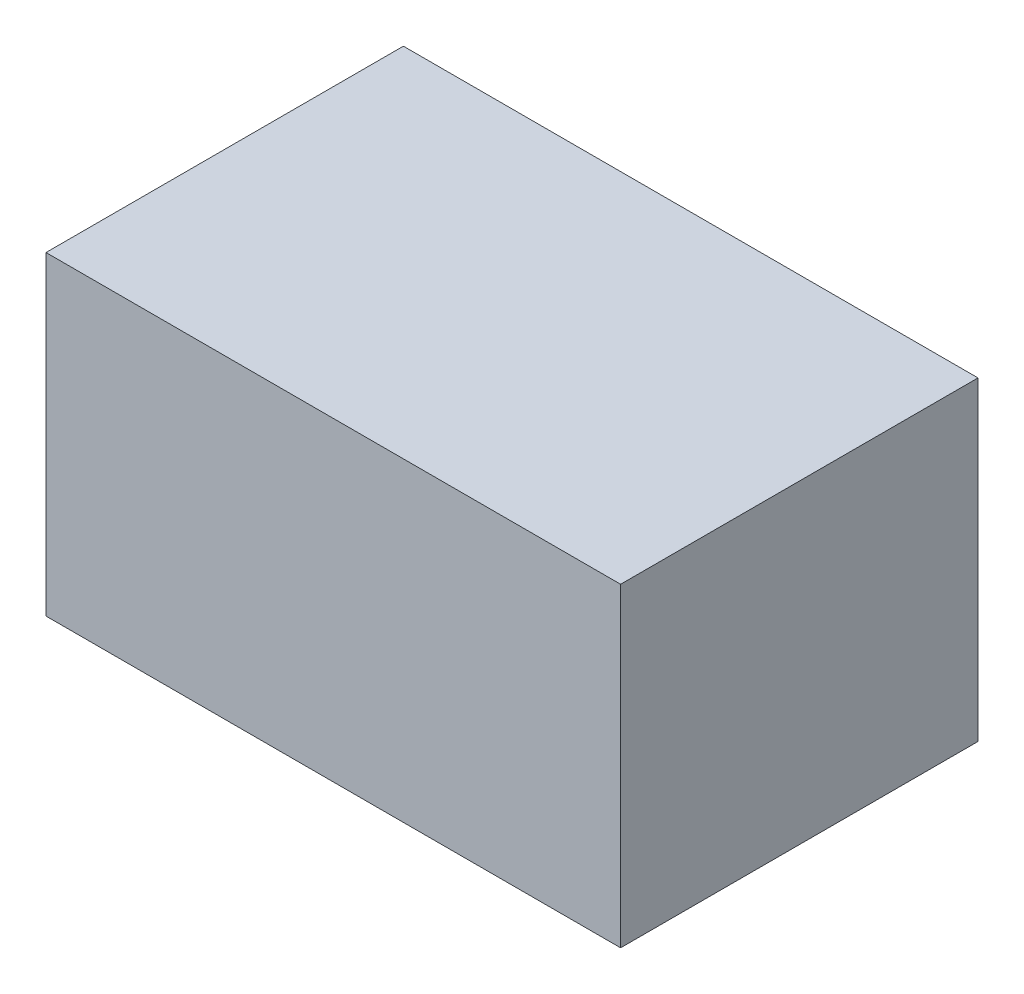
from build123d import *

# Parameters (mm, degrees)
CURVESKETCH_W   = 31.719
CURVESKETCH_H   = 17.381
CURVEBOSS_DEPTH = 9.8645


with BuildPart() as part:
    # CurveSketch → CurveBoss (new, symmetric)
    with BuildSketch(Plane.XY):
        with Locations((-4.193, 6.827)):
            Rectangle(CURVESKETCH_W, CURVESKETCH_H)
    extrude(amount=CURVEBOSS_DEPTH, both=True)


solid = part.part
